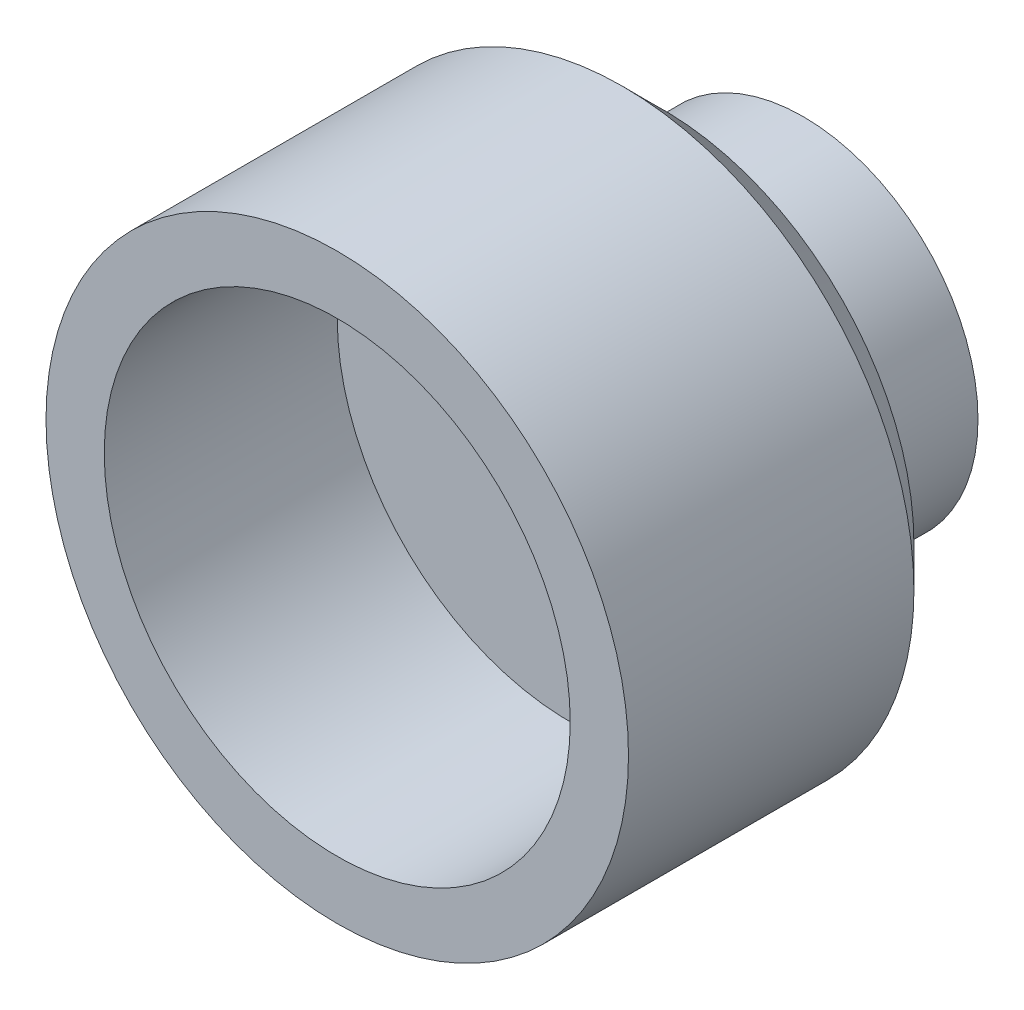
from build123d import *

# Parameters (mm, degrees)
FASE1_SIZE = 0.35


with BuildPart() as part:
    # Sketch1 → Revolve1 (revolve)
    with BuildSketch(Plane(origin=(0, 0, 0), x_dir=(0, 0, -1), z_dir=(1, 0, 0)), mode=Mode.PRIVATE) as revolve1_sk:
        Polygon((0, 2.5), (2.8, 2.5), (2.8, 1.5), (4, 1.5), (4, 0.5), (2, 0.5), (2, 2), (0, 2), align=None)
    revolve(revolve1_sk.sketch.rotate(Axis((0, 0, 20.700415561), (0, 0, -1)), 90), axis=Axis((0, 0, 20.700415561), (0, 0, -1)))

    # Fase1
    fase1_edges = [part.edges().sort_by_distance(p)[0] for p in [
        (-2.5, 0, -2.8),
    ]]
    chamfer(fase1_edges, length=FASE1_SIZE)


solid = part.part
